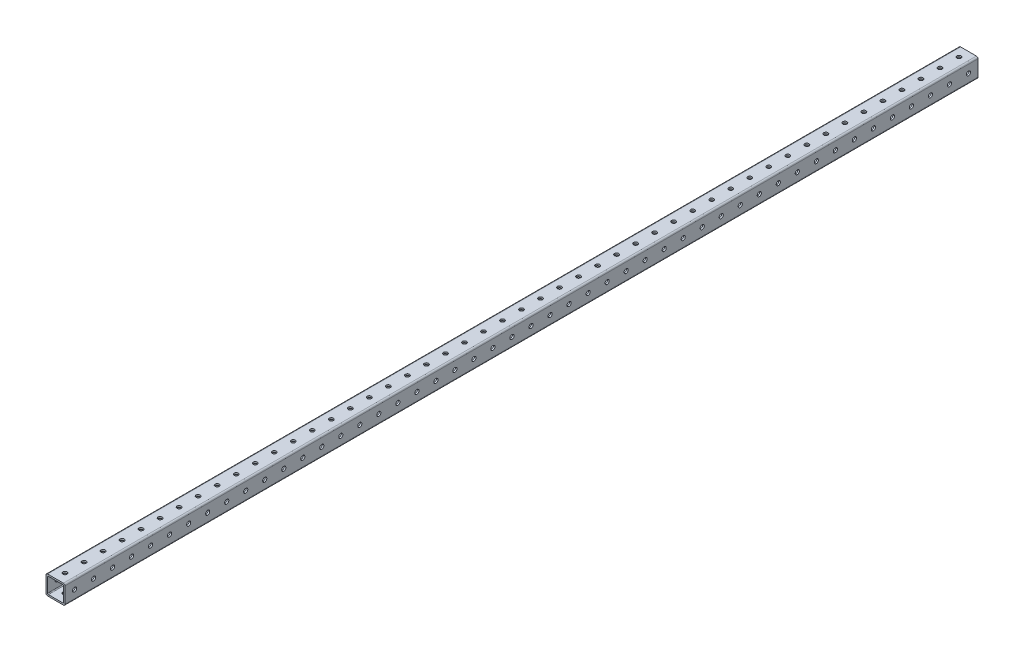
from build123d import *

# Parameters (mm, degrees)
BOSS_EXTRUDE1_DEPTH          = 914.4
BOSS_EXTRUDE1_DEPTH_BACK     = 914.4
SKETCH4_R                    = 4.1656
CUT_EXTRUDE1_DEPTH           = 915.79678891
LPATTERN1_COUNT              = 48
LPATTERN1_PITCH              = 38.1
CIRPATTERN1_COUNT            = 2
CIRPATTERN1_ANGLE            = 90
CIRPATTERN1_COPY_1_SKETCH_R  = 4.1656
CIRPATTERN1_COPY_1_DEPTH     = 915.79678891
CIRPATTERN1_COPY_2_SKETCH_R  = 4.1656
CIRPATTERN1_COPY_2_DEPTH     = 915.79678891
CIRPATTERN1_COPY_3_SKETCH_R  = 4.1656
CIRPATTERN1_COPY_3_DEPTH     = 915.79678891
CIRPATTERN1_COPY_4_SKETCH_R  = 4.1656
CIRPATTERN1_COPY_4_DEPTH     = 915.79678891
CIRPATTERN1_COPY_5_SKETCH_R  = 4.1656
CIRPATTERN1_COPY_5_DEPTH     = 915.79678891
CIRPATTERN1_COPY_6_SKETCH_R  = 4.1656
CIRPATTERN1_COPY_6_DEPTH     = 915.79678891
CIRPATTERN1_COPY_7_SKETCH_R  = 4.1656
CIRPATTERN1_COPY_7_DEPTH     = 915.79678891
CIRPATTERN1_COPY_8_SKETCH_R  = 4.1656
CIRPATTERN1_COPY_8_DEPTH     = 915.79678891
CIRPATTERN1_COPY_9_SKETCH_R  = 4.1656
CIRPATTERN1_COPY_9_DEPTH     = 915.79678891
CIRPATTERN1_COPY_10_SKETCH_R = 4.1656
CIRPATTERN1_COPY_10_DEPTH    = 915.79678891
CIRPATTERN1_COPY_11_SKETCH_R = 4.1656
CIRPATTERN1_COPY_11_DEPTH    = 915.79678891
CIRPATTERN1_COPY_12_SKETCH_R = 4.1656
CIRPATTERN1_COPY_12_DEPTH    = 915.79678891
CIRPATTERN1_COPY_13_SKETCH_R = 4.1656
CIRPATTERN1_COPY_13_DEPTH    = 915.79678891
CIRPATTERN1_COPY_14_SKETCH_R = 4.1656
CIRPATTERN1_COPY_14_DEPTH    = 915.79678891
CIRPATTERN1_COPY_15_SKETCH_R = 4.1656
CIRPATTERN1_COPY_15_DEPTH    = 915.79678891
CIRPATTERN1_COPY_16_SKETCH_R = 4.1656
CIRPATTERN1_COPY_16_DEPTH    = 915.79678891
CIRPATTERN1_COPY_17_SKETCH_R = 4.1656
CIRPATTERN1_COPY_17_DEPTH    = 915.79678891
CIRPATTERN1_COPY_18_SKETCH_R = 4.1656
CIRPATTERN1_COPY_18_DEPTH    = 915.79678891
CIRPATTERN1_COPY_19_SKETCH_R = 4.1656
CIRPATTERN1_COPY_19_DEPTH    = 915.79678891
CIRPATTERN1_COPY_20_SKETCH_R = 4.1656
CIRPATTERN1_COPY_20_DEPTH    = 915.79678891
CIRPATTERN1_COPY_21_SKETCH_R = 4.1656
CIRPATTERN1_COPY_21_DEPTH    = 915.79678891
CIRPATTERN1_COPY_22_SKETCH_R = 4.1656
CIRPATTERN1_COPY_22_DEPTH    = 915.79678891
CIRPATTERN1_COPY_23_SKETCH_R = 4.1656
CIRPATTERN1_COPY_23_DEPTH    = 915.79678891
CIRPATTERN1_COPY_24_SKETCH_R = 4.1656
CIRPATTERN1_COPY_24_DEPTH    = 915.79678891
CIRPATTERN1_COPY_25_SKETCH_R = 4.1656
CIRPATTERN1_COPY_25_DEPTH    = 915.79678891
CIRPATTERN1_COPY_26_SKETCH_R = 4.1656
CIRPATTERN1_COPY_26_DEPTH    = 915.79678891
CIRPATTERN1_COPY_27_SKETCH_R = 4.1656
CIRPATTERN1_COPY_27_DEPTH    = 915.79678891
CIRPATTERN1_COPY_28_SKETCH_R = 4.1656
CIRPATTERN1_COPY_28_DEPTH    = 915.79678891
CIRPATTERN1_COPY_29_SKETCH_R = 4.1656
CIRPATTERN1_COPY_29_DEPTH    = 915.79678891
CIRPATTERN1_COPY_30_SKETCH_R = 4.1656
CIRPATTERN1_COPY_30_DEPTH    = 915.79678891
CIRPATTERN1_COPY_31_SKETCH_R = 4.1656
CIRPATTERN1_COPY_31_DEPTH    = 915.79678891
CIRPATTERN1_COPY_32_SKETCH_R = 4.1656
CIRPATTERN1_COPY_32_DEPTH    = 915.79678891
CIRPATTERN1_COPY_33_SKETCH_R = 4.1656
CIRPATTERN1_COPY_33_DEPTH    = 915.79678891
CIRPATTERN1_COPY_34_SKETCH_R = 4.1656
CIRPATTERN1_COPY_34_DEPTH    = 915.79678891
CIRPATTERN1_COPY_35_SKETCH_R = 4.1656
CIRPATTERN1_COPY_35_DEPTH    = 915.79678891
CIRPATTERN1_COPY_36_SKETCH_R = 4.1656
CIRPATTERN1_COPY_36_DEPTH    = 915.79678891
CIRPATTERN1_COPY_37_SKETCH_R = 4.1656
CIRPATTERN1_COPY_37_DEPTH    = 915.79678891
CIRPATTERN1_COPY_38_SKETCH_R = 4.1656
CIRPATTERN1_COPY_38_DEPTH    = 915.79678891
CIRPATTERN1_COPY_39_SKETCH_R = 4.1656
CIRPATTERN1_COPY_39_DEPTH    = 915.79678891
CIRPATTERN1_COPY_40_SKETCH_R = 4.1656
CIRPATTERN1_COPY_40_DEPTH    = 915.79678891
CIRPATTERN1_COPY_41_SKETCH_R = 4.1656
CIRPATTERN1_COPY_41_DEPTH    = 915.79678891
CIRPATTERN1_COPY_42_SKETCH_R = 4.1656
CIRPATTERN1_COPY_42_DEPTH    = 915.79678891
CIRPATTERN1_COPY_43_SKETCH_R = 4.1656
CIRPATTERN1_COPY_43_DEPTH    = 915.79678891
CIRPATTERN1_COPY_44_SKETCH_R = 4.1656
CIRPATTERN1_COPY_44_DEPTH    = 915.79678891
CIRPATTERN1_COPY_45_SKETCH_R = 4.1656
CIRPATTERN1_COPY_45_DEPTH    = 915.79678891
CIRPATTERN1_COPY_46_SKETCH_R = 4.1656
CIRPATTERN1_COPY_46_DEPTH    = 915.79678891
CIRPATTERN1_COPY_47_SKETCH_R = 4.1656
CIRPATTERN1_COPY_47_DEPTH    = 915.79678891


with BuildPart() as part:
    # Sketch3 → Boss-Extrude1 (new, two sides: drawn at the far end of the back side and taken through both)
    with BuildSketch(Plane.XY.offset(-BOSS_EXTRUDE1_DEPTH_BACK)):
        with BuildLine():
            Line((15.875, 19.05), (-15.875, 19.05))
            ThreePointArc((-15.875, 19.05), (-18.12006403, 18.12006403), (-19.05, 15.875))
            Line((-19.05, 15.875), (-19.05, -15.875))
            ThreePointArc((-19.05, -15.875), (-18.12006403, -18.12006403), (-15.875, -19.05))
            Line((-15.875, -19.05), (15.875, -19.05))
            ThreePointArc((15.875, -19.05), (18.12006403, -18.12006403), (19.05, -15.875))
            Line((19.05, -15.875), (19.05, 15.875))
            ThreePointArc((19.05, 15.875), (18.12006403, 18.12006403), (15.875, 19.05))
        make_face()
        with BuildLine():
            Line((-14.2875, -15.875), (14.2875, -15.875))
            ThreePointArc((14.2875, -15.875), (15.410032015, -15.410032015), (15.875, -14.2875))
            Line((15.875, -14.2875), (15.875, 14.2875))
            ThreePointArc((15.875, 14.2875), (15.410032015, 15.410032015), (14.2875, 15.875))
            Line((14.2875, 15.875), (-14.2875, 15.875))
            ThreePointArc((-14.2875, 15.875), (-15.410032015, 15.410032015), (-15.875, 14.2875))
            Line((-15.875, 14.2875), (-15.875, -14.2875))
            ThreePointArc((-15.875, -14.2875), (-15.410032015, -15.410032015), (-14.2875, -15.875))
        make_face(mode=Mode.SUBTRACT)
    extrude(amount=BOSS_EXTRUDE1_DEPTH + BOSS_EXTRUDE1_DEPTH_BACK)

    # Sketch4 → Cut-Extrude1 (cut, symmetric)
    with BuildSketch(Plane(origin=(0, 0, 0), x_dir=(0, 0, -1), z_dir=(1, 0, 0))):
        with Locations((-895.35, 0)):
            Circle(SKETCH4_R)
    cut_extrude1 = extrude(amount=CUT_EXTRUDE1_DEPTH, both=True, mode=Mode.SUBTRACT)

    # LPattern1: Cut-Extrude1 ×48
    with Locations(*[(0, 0, -i * LPATTERN1_PITCH) for i in range(1, LPATTERN1_COUNT)]):
        add(cut_extrude1, mode=Mode.SUBTRACT)

    # CirPattern1: Cut-Extrude1 ×2 about axis
    cirpattern1_axis = Axis((0, 0, -670.56), (0, 0, 1))
    for i in range(1, CIRPATTERN1_COUNT):
        add(cut_extrude1.rotate(cirpattern1_axis, i * CIRPATTERN1_ANGLE / (CIRPATTERN1_COUNT - 1)), mode=Mode.SUBTRACT)

    # CirPattern1 copy 1 sketch → CirPattern1 copy 1 (cut, symmetric)
    with BuildSketch(Plane(origin=(0, 0, -38.1), x_dir=(0, 0, -1), z_dir=(0, 1, 0))):
        with Locations((-895.35, 0)):
            Circle(CIRPATTERN1_COPY_1_SKETCH_R)
    extrude(amount=CIRPATTERN1_COPY_1_DEPTH, both=True, mode=Mode.SUBTRACT)

    # CirPattern1 copy 2 sketch → CirPattern1 copy 2 (cut, symmetric)
    with BuildSketch(Plane(origin=(0, 0, -76.2), x_dir=(0, 0, -1), z_dir=(0, 1, 0))):
        with Locations((-895.35, 0)):
            Circle(CIRPATTERN1_COPY_2_SKETCH_R)
    extrude(amount=CIRPATTERN1_COPY_2_DEPTH, both=True, mode=Mode.SUBTRACT)

    # CirPattern1 copy 3 sketch → CirPattern1 copy 3 (cut, symmetric)
    with BuildSketch(Plane(origin=(0, 0, -114.3), x_dir=(0, 0, -1), z_dir=(0, 1, 0))):
        with Locations((-895.35, 0)):
            Circle(CIRPATTERN1_COPY_3_SKETCH_R)
    extrude(amount=CIRPATTERN1_COPY_3_DEPTH, both=True, mode=Mode.SUBTRACT)

    # CirPattern1 copy 4 sketch → CirPattern1 copy 4 (cut, symmetric)
    with BuildSketch(Plane(origin=(0, 0, -152.4), x_dir=(0, 0, -1), z_dir=(0, 1, 0))):
        with Locations((-895.35, 0)):
            Circle(CIRPATTERN1_COPY_4_SKETCH_R)
    extrude(amount=CIRPATTERN1_COPY_4_DEPTH, both=True, mode=Mode.SUBTRACT)

    # CirPattern1 copy 5 sketch → CirPattern1 copy 5 (cut, symmetric)
    with BuildSketch(Plane(origin=(0, 0, -190.5), x_dir=(0, 0, -1), z_dir=(0, 1, 0))):
        with Locations((-895.35, 0)):
            Circle(CIRPATTERN1_COPY_5_SKETCH_R)
    extrude(amount=CIRPATTERN1_COPY_5_DEPTH, both=True, mode=Mode.SUBTRACT)

    # CirPattern1 copy 6 sketch → CirPattern1 copy 6 (cut, symmetric)
    with BuildSketch(Plane(origin=(0, 0, -228.6), x_dir=(0, 0, -1), z_dir=(0, 1, 0))):
        with Locations((-895.35, 0)):
            Circle(CIRPATTERN1_COPY_6_SKETCH_R)
    extrude(amount=CIRPATTERN1_COPY_6_DEPTH, both=True, mode=Mode.SUBTRACT)

    # CirPattern1 copy 7 sketch → CirPattern1 copy 7 (cut, symmetric)
    with BuildSketch(Plane(origin=(0, 0, -266.7), x_dir=(0, 0, -1), z_dir=(0, 1, 0))):
        with Locations((-895.35, 0)):
            Circle(CIRPATTERN1_COPY_7_SKETCH_R)
    extrude(amount=CIRPATTERN1_COPY_7_DEPTH, both=True, mode=Mode.SUBTRACT)

    # CirPattern1 copy 8 sketch → CirPattern1 copy 8 (cut, symmetric)
    with BuildSketch(Plane(origin=(0, 0, -304.8), x_dir=(0, 0, -1), z_dir=(0, 1, 0))):
        with Locations((-895.35, 0)):
            Circle(CIRPATTERN1_COPY_8_SKETCH_R)
    extrude(amount=CIRPATTERN1_COPY_8_DEPTH, both=True, mode=Mode.SUBTRACT)

    # CirPattern1 copy 9 sketch → CirPattern1 copy 9 (cut, symmetric)
    with BuildSketch(Plane(origin=(0, 0, -342.9), x_dir=(0, 0, -1), z_dir=(0, 1, 0))):
        with Locations((-895.35, 0)):
            Circle(CIRPATTERN1_COPY_9_SKETCH_R)
    extrude(amount=CIRPATTERN1_COPY_9_DEPTH, both=True, mode=Mode.SUBTRACT)

    # CirPattern1 copy 10 sketch → CirPattern1 copy 10 (cut, symmetric)
    with BuildSketch(Plane(origin=(0, 0, -381), x_dir=(0, 0, -1), z_dir=(0, 1, 0))):
        with Locations((-895.35, 0)):
            Circle(CIRPATTERN1_COPY_10_SKETCH_R)
    extrude(amount=CIRPATTERN1_COPY_10_DEPTH, both=True, mode=Mode.SUBTRACT)

    # CirPattern1 copy 11 sketch → CirPattern1 copy 11 (cut, symmetric)
    with BuildSketch(Plane(origin=(0, 0, -419.1), x_dir=(0, 0, -1), z_dir=(0, 1, 0))):
        with Locations((-895.35, 0)):
            Circle(CIRPATTERN1_COPY_11_SKETCH_R)
    extrude(amount=CIRPATTERN1_COPY_11_DEPTH, both=True, mode=Mode.SUBTRACT)

    # CirPattern1 copy 12 sketch → CirPattern1 copy 12 (cut, symmetric)
    with BuildSketch(Plane(origin=(0, 0, -457.2), x_dir=(0, 0, -1), z_dir=(0, 1, 0))):
        with Locations((-895.35, 0)):
            Circle(CIRPATTERN1_COPY_12_SKETCH_R)
    extrude(amount=CIRPATTERN1_COPY_12_DEPTH, both=True, mode=Mode.SUBTRACT)

    # CirPattern1 copy 13 sketch → CirPattern1 copy 13 (cut, symmetric)
    with BuildSketch(Plane(origin=(0, 0, -495.3), x_dir=(0, 0, -1), z_dir=(0, 1, 0))):
        with Locations((-895.35, 0)):
            Circle(CIRPATTERN1_COPY_13_SKETCH_R)
    extrude(amount=CIRPATTERN1_COPY_13_DEPTH, both=True, mode=Mode.SUBTRACT)

    # CirPattern1 copy 14 sketch → CirPattern1 copy 14 (cut, symmetric)
    with BuildSketch(Plane(origin=(0, 0, -533.4), x_dir=(0, 0, -1), z_dir=(0, 1, 0))):
        with Locations((-895.35, 0)):
            Circle(CIRPATTERN1_COPY_14_SKETCH_R)
    extrude(amount=CIRPATTERN1_COPY_14_DEPTH, both=True, mode=Mode.SUBTRACT)

    # CirPattern1 copy 15 sketch → CirPattern1 copy 15 (cut, symmetric)
    with BuildSketch(Plane(origin=(0, 0, -571.5), x_dir=(0, 0, -1), z_dir=(0, 1, 0))):
        with Locations((-895.35, 0)):
            Circle(CIRPATTERN1_COPY_15_SKETCH_R)
    extrude(amount=CIRPATTERN1_COPY_15_DEPTH, both=True, mode=Mode.SUBTRACT)

    # CirPattern1 copy 16 sketch → CirPattern1 copy 16 (cut, symmetric)
    with BuildSketch(Plane(origin=(0, 0, -609.6), x_dir=(0, 0, -1), z_dir=(0, 1, 0))):
        with Locations((-895.35, 0)):
            Circle(CIRPATTERN1_COPY_16_SKETCH_R)
    extrude(amount=CIRPATTERN1_COPY_16_DEPTH, both=True, mode=Mode.SUBTRACT)

    # CirPattern1 copy 17 sketch → CirPattern1 copy 17 (cut, symmetric)
    with BuildSketch(Plane(origin=(0, 0, -647.7), x_dir=(0, 0, -1), z_dir=(0, 1, 0))):
        with Locations((-895.35, 0)):
            Circle(CIRPATTERN1_COPY_17_SKETCH_R)
    extrude(amount=CIRPATTERN1_COPY_17_DEPTH, both=True, mode=Mode.SUBTRACT)

    # CirPattern1 copy 18 sketch → CirPattern1 copy 18 (cut, symmetric)
    with BuildSketch(Plane(origin=(0, 0, -685.8), x_dir=(0, 0, -1), z_dir=(0, 1, 0))):
        with Locations((-895.35, 0)):
            Circle(CIRPATTERN1_COPY_18_SKETCH_R)
    extrude(amount=CIRPATTERN1_COPY_18_DEPTH, both=True, mode=Mode.SUBTRACT)

    # CirPattern1 copy 19 sketch → CirPattern1 copy 19 (cut, symmetric)
    with BuildSketch(Plane(origin=(0, 0, -723.9), x_dir=(0, 0, -1), z_dir=(0, 1, 0))):
        with Locations((-895.35, 0)):
            Circle(CIRPATTERN1_COPY_19_SKETCH_R)
    extrude(amount=CIRPATTERN1_COPY_19_DEPTH, both=True, mode=Mode.SUBTRACT)

    # CirPattern1 copy 20 sketch → CirPattern1 copy 20 (cut, symmetric)
    with BuildSketch(Plane(origin=(0, 0, -762), x_dir=(0, 0, -1), z_dir=(0, 1, 0))):
        with Locations((-895.35, 0)):
            Circle(CIRPATTERN1_COPY_20_SKETCH_R)
    extrude(amount=CIRPATTERN1_COPY_20_DEPTH, both=True, mode=Mode.SUBTRACT)

    # CirPattern1 copy 21 sketch → CirPattern1 copy 21 (cut, symmetric)
    with BuildSketch(Plane(origin=(0, 0, -800.1), x_dir=(0, 0, -1), z_dir=(0, 1, 0))):
        with Locations((-895.35, 0)):
            Circle(CIRPATTERN1_COPY_21_SKETCH_R)
    extrude(amount=CIRPATTERN1_COPY_21_DEPTH, both=True, mode=Mode.SUBTRACT)

    # CirPattern1 copy 22 sketch → CirPattern1 copy 22 (cut, symmetric)
    with BuildSketch(Plane(origin=(0, 0, -838.2), x_dir=(0, 0, -1), z_dir=(0, 1, 0))):
        with Locations((-895.35, 0)):
            Circle(CIRPATTERN1_COPY_22_SKETCH_R)
    extrude(amount=CIRPATTERN1_COPY_22_DEPTH, both=True, mode=Mode.SUBTRACT)

    # CirPattern1 copy 23 sketch → CirPattern1 copy 23 (cut, symmetric)
    with BuildSketch(Plane(origin=(0, 0, -876.3), x_dir=(0, 0, -1), z_dir=(0, 1, 0))):
        with Locations((-895.35, 0)):
            Circle(CIRPATTERN1_COPY_23_SKETCH_R)
    extrude(amount=CIRPATTERN1_COPY_23_DEPTH, both=True, mode=Mode.SUBTRACT)

    # CirPattern1 copy 24 sketch → CirPattern1 copy 24 (cut, symmetric)
    with BuildSketch(Plane(origin=(0, 0, -914.4), x_dir=(0, 0, -1), z_dir=(0, 1, 0))):
        with Locations((-895.35, 0)):
            Circle(CIRPATTERN1_COPY_24_SKETCH_R)
    extrude(amount=CIRPATTERN1_COPY_24_DEPTH, both=True, mode=Mode.SUBTRACT)

    # CirPattern1 copy 25 sketch → CirPattern1 copy 25 (cut, symmetric)
    with BuildSketch(Plane(origin=(0, 0, -952.5), x_dir=(0, 0, -1), z_dir=(0, 1, 0))):
        with Locations((-895.35, 0)):
            Circle(CIRPATTERN1_COPY_25_SKETCH_R)
    extrude(amount=CIRPATTERN1_COPY_25_DEPTH, both=True, mode=Mode.SUBTRACT)

    # CirPattern1 copy 26 sketch → CirPattern1 copy 26 (cut, symmetric)
    with BuildSketch(Plane(origin=(0, 0, -990.6), x_dir=(0, 0, -1), z_dir=(0, 1, 0))):
        with Locations((-895.35, 0)):
            Circle(CIRPATTERN1_COPY_26_SKETCH_R)
    extrude(amount=CIRPATTERN1_COPY_26_DEPTH, both=True, mode=Mode.SUBTRACT)

    # CirPattern1 copy 27 sketch → CirPattern1 copy 27 (cut, symmetric)
    with BuildSketch(Plane(origin=(0, 0, -1028.7), x_dir=(0, 0, -1), z_dir=(0, 1, 0))):
        with Locations((-895.35, 0)):
            Circle(CIRPATTERN1_COPY_27_SKETCH_R)
    extrude(amount=CIRPATTERN1_COPY_27_DEPTH, both=True, mode=Mode.SUBTRACT)

    # CirPattern1 copy 28 sketch → CirPattern1 copy 28 (cut, symmetric)
    with BuildSketch(Plane(origin=(0, 0, -1066.8), x_dir=(0, 0, -1), z_dir=(0, 1, 0))):
        with Locations((-895.35, 0)):
            Circle(CIRPATTERN1_COPY_28_SKETCH_R)
    extrude(amount=CIRPATTERN1_COPY_28_DEPTH, both=True, mode=Mode.SUBTRACT)

    # CirPattern1 copy 29 sketch → CirPattern1 copy 29 (cut, symmetric)
    with BuildSketch(Plane(origin=(0, 0, -1104.9), x_dir=(0, 0, -1), z_dir=(0, 1, 0))):
        with Locations((-895.35, 0)):
            Circle(CIRPATTERN1_COPY_29_SKETCH_R)
    extrude(amount=CIRPATTERN1_COPY_29_DEPTH, both=True, mode=Mode.SUBTRACT)

    # CirPattern1 copy 30 sketch → CirPattern1 copy 30 (cut, symmetric)
    with BuildSketch(Plane(origin=(0, 0, -1143), x_dir=(0, 0, -1), z_dir=(0, 1, 0))):
        with Locations((-895.35, 0)):
            Circle(CIRPATTERN1_COPY_30_SKETCH_R)
    extrude(amount=CIRPATTERN1_COPY_30_DEPTH, both=True, mode=Mode.SUBTRACT)

    # CirPattern1 copy 31 sketch → CirPattern1 copy 31 (cut, symmetric)
    with BuildSketch(Plane(origin=(0, 0, -1181.1), x_dir=(0, 0, -1), z_dir=(0, 1, 0))):
        with Locations((-895.35, 0)):
            Circle(CIRPATTERN1_COPY_31_SKETCH_R)
    extrude(amount=CIRPATTERN1_COPY_31_DEPTH, both=True, mode=Mode.SUBTRACT)

    # CirPattern1 copy 32 sketch → CirPattern1 copy 32 (cut, symmetric)
    with BuildSketch(Plane(origin=(0, 0, -1219.2), x_dir=(0, 0, -1), z_dir=(0, 1, 0))):
        with Locations((-895.35, 0)):
            Circle(CIRPATTERN1_COPY_32_SKETCH_R)
    extrude(amount=CIRPATTERN1_COPY_32_DEPTH, both=True, mode=Mode.SUBTRACT)

    # CirPattern1 copy 33 sketch → CirPattern1 copy 33 (cut, symmetric)
    with BuildSketch(Plane(origin=(0, 0, -1257.3), x_dir=(0, 0, -1), z_dir=(0, 1, 0))):
        with Locations((-895.35, 0)):
            Circle(CIRPATTERN1_COPY_33_SKETCH_R)
    extrude(amount=CIRPATTERN1_COPY_33_DEPTH, both=True, mode=Mode.SUBTRACT)

    # CirPattern1 copy 34 sketch → CirPattern1 copy 34 (cut, symmetric)
    with BuildSketch(Plane(origin=(0, 0, -1295.4), x_dir=(0, 0, -1), z_dir=(0, 1, 0))):
        with Locations((-895.35, 0)):
            Circle(CIRPATTERN1_COPY_34_SKETCH_R)
    extrude(amount=CIRPATTERN1_COPY_34_DEPTH, both=True, mode=Mode.SUBTRACT)

    # CirPattern1 copy 35 sketch → CirPattern1 copy 35 (cut, symmetric)
    with BuildSketch(Plane(origin=(0, 0, -1333.5), x_dir=(0, 0, -1), z_dir=(0, 1, 0))):
        with Locations((-895.35, 0)):
            Circle(CIRPATTERN1_COPY_35_SKETCH_R)
    extrude(amount=CIRPATTERN1_COPY_35_DEPTH, both=True, mode=Mode.SUBTRACT)

    # CirPattern1 copy 36 sketch → CirPattern1 copy 36 (cut, symmetric)
    with BuildSketch(Plane(origin=(0, 0, -1371.6), x_dir=(0, 0, -1), z_dir=(0, 1, 0))):
        with Locations((-895.35, 0)):
            Circle(CIRPATTERN1_COPY_36_SKETCH_R)
    extrude(amount=CIRPATTERN1_COPY_36_DEPTH, both=True, mode=Mode.SUBTRACT)

    # CirPattern1 copy 37 sketch → CirPattern1 copy 37 (cut, symmetric)
    with BuildSketch(Plane(origin=(0, 0, -1409.7), x_dir=(0, 0, -1), z_dir=(0, 1, 0))):
        with Locations((-895.35, 0)):
            Circle(CIRPATTERN1_COPY_37_SKETCH_R)
    extrude(amount=CIRPATTERN1_COPY_37_DEPTH, both=True, mode=Mode.SUBTRACT)

    # CirPattern1 copy 38 sketch → CirPattern1 copy 38 (cut, symmetric)
    with BuildSketch(Plane(origin=(0, 0, -1447.8), x_dir=(0, 0, -1), z_dir=(0, 1, 0))):
        with Locations((-895.35, 0)):
            Circle(CIRPATTERN1_COPY_38_SKETCH_R)
    extrude(amount=CIRPATTERN1_COPY_38_DEPTH, both=True, mode=Mode.SUBTRACT)

    # CirPattern1 copy 39 sketch → CirPattern1 copy 39 (cut, symmetric)
    with BuildSketch(Plane(origin=(0, 0, -1485.9), x_dir=(0, 0, -1), z_dir=(0, 1, 0))):
        with Locations((-895.35, 0)):
            Circle(CIRPATTERN1_COPY_39_SKETCH_R)
    extrude(amount=CIRPATTERN1_COPY_39_DEPTH, both=True, mode=Mode.SUBTRACT)

    # CirPattern1 copy 40 sketch → CirPattern1 copy 40 (cut, symmetric)
    with BuildSketch(Plane(origin=(0, 0, -1524), x_dir=(0, 0, -1), z_dir=(0, 1, 0))):
        with Locations((-895.35, 0)):
            Circle(CIRPATTERN1_COPY_40_SKETCH_R)
    extrude(amount=CIRPATTERN1_COPY_40_DEPTH, both=True, mode=Mode.SUBTRACT)

    # CirPattern1 copy 41 sketch → CirPattern1 copy 41 (cut, symmetric)
    with BuildSketch(Plane(origin=(0, 0, -1562.1), x_dir=(0, 0, -1), z_dir=(0, 1, 0))):
        with Locations((-895.35, 0)):
            Circle(CIRPATTERN1_COPY_41_SKETCH_R)
    extrude(amount=CIRPATTERN1_COPY_41_DEPTH, both=True, mode=Mode.SUBTRACT)

    # CirPattern1 copy 42 sketch → CirPattern1 copy 42 (cut, symmetric)
    with BuildSketch(Plane(origin=(0, 0, -1600.2), x_dir=(0, 0, -1), z_dir=(0, 1, 0))):
        with Locations((-895.35, 0)):
            Circle(CIRPATTERN1_COPY_42_SKETCH_R)
    extrude(amount=CIRPATTERN1_COPY_42_DEPTH, both=True, mode=Mode.SUBTRACT)

    # CirPattern1 copy 43 sketch → CirPattern1 copy 43 (cut, symmetric)
    with BuildSketch(Plane(origin=(0, 0, -1638.3), x_dir=(0, 0, -1), z_dir=(0, 1, 0))):
        with Locations((-895.35, 0)):
            Circle(CIRPATTERN1_COPY_43_SKETCH_R)
    extrude(amount=CIRPATTERN1_COPY_43_DEPTH, both=True, mode=Mode.SUBTRACT)

    # CirPattern1 copy 44 sketch → CirPattern1 copy 44 (cut, symmetric)
    with BuildSketch(Plane(origin=(0, 0, -1676.4), x_dir=(0, 0, -1), z_dir=(0, 1, 0))):
        with Locations((-895.35, 0)):
            Circle(CIRPATTERN1_COPY_44_SKETCH_R)
    extrude(amount=CIRPATTERN1_COPY_44_DEPTH, both=True, mode=Mode.SUBTRACT)

    # CirPattern1 copy 45 sketch → CirPattern1 copy 45 (cut, symmetric)
    with BuildSketch(Plane(origin=(0, 0, -1714.5), x_dir=(0, 0, -1), z_dir=(0, 1, 0))):
        with Locations((-895.35, 0)):
            Circle(CIRPATTERN1_COPY_45_SKETCH_R)
    extrude(amount=CIRPATTERN1_COPY_45_DEPTH, both=True, mode=Mode.SUBTRACT)

    # CirPattern1 copy 46 sketch → CirPattern1 copy 46 (cut, symmetric)
    with BuildSketch(Plane(origin=(0, 0, -1752.6), x_dir=(0, 0, -1), z_dir=(0, 1, 0))):
        with Locations((-895.35, 0)):
            Circle(CIRPATTERN1_COPY_46_SKETCH_R)
    extrude(amount=CIRPATTERN1_COPY_46_DEPTH, both=True, mode=Mode.SUBTRACT)

    # CirPattern1 copy 47 sketch → CirPattern1 copy 47 (cut, symmetric)
    with BuildSketch(Plane(origin=(0, 0, -1790.7), x_dir=(0, 0, -1), z_dir=(0, 1, 0))):
        with Locations((-895.35, 0)):
            Circle(CIRPATTERN1_COPY_47_SKETCH_R)
    extrude(amount=CIRPATTERN1_COPY_47_DEPTH, both=True, mode=Mode.SUBTRACT)


solid = part.part
